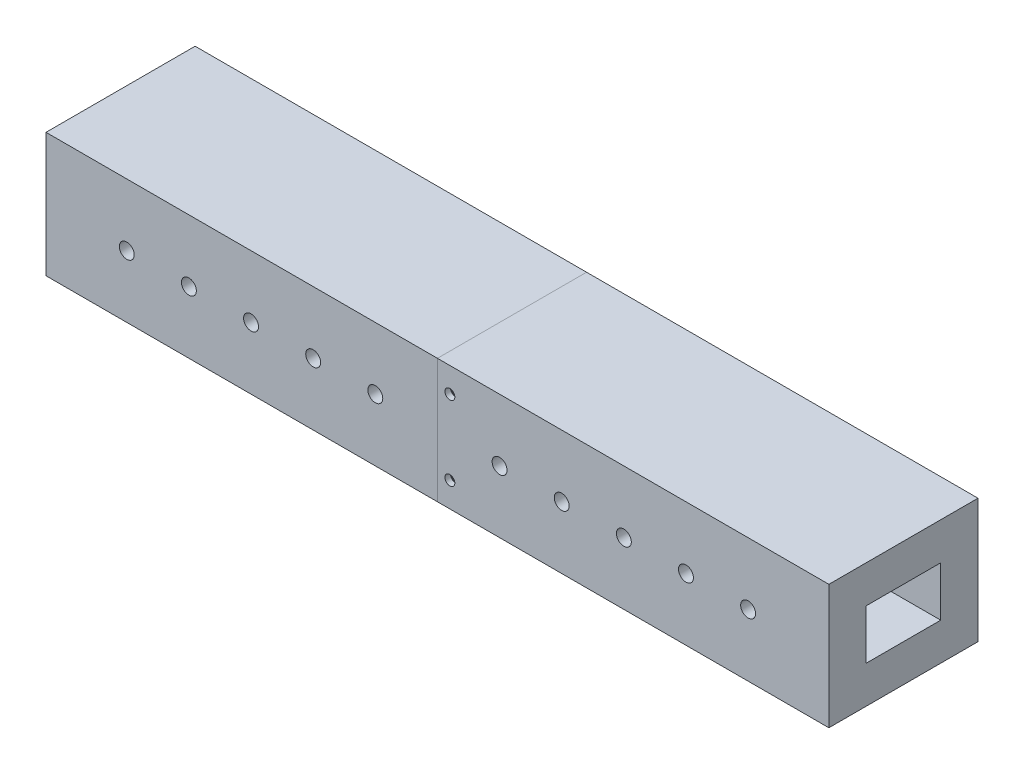
from build123d import *

# Parameters (mm, degrees)
SKETCH1_W           = 315
SKETCH1_H           = 60
BOSS_EXTRUDE1_DEPTH = 50
SKETCH2_W           = 30
SKETCH2_H           = 20
CUT_EXTRUDE1_DEPTH  = 321.351369593
SKETCH3_R           = 3
CUT_EXTRUDE2_DEPTH  = 10
SKETCH4_W           = 10.5
SKETCH4_H           = 45.5
CUT_EXTRUDE3_DEPTH  = 10
SKETCH5_R           = 2
CUT_EXTRUDE4_DEPTH  = 10
SKETCH6_W           = 10
SKETCH6_H           = 45
BOSS_EXTRUDE2_DEPTH = 10
SKETCH8_R           = 2
CUT_EXTRUDE6_DEPTH  = 175.964282069
SKETCH9_R           = 2
CUT_EXTRUDE7_DEPTH  = 10
SKETCH10_R          = 2
CUT_EXTRUDE8_DEPTH  = 10


with BuildPart() as part:
    # Sketch1 → Boss-Extrude1 (new body)
    with BuildSketch(Plane(origin=(0, 0, 0), x_dir=(1, 0, 0), z_dir=(0, 1, 0))):
        Rectangle(SKETCH1_W, SKETCH1_H)
    extrude(amount=BOSS_EXTRUDE1_DEPTH)

    # Sketch2 → Cut-Extrude1 (cut, through all)
    with BuildSketch(Plane.ZY.offset(157.5)):
        with Locations((0, 25)):
            Rectangle(SKETCH2_W, SKETCH2_H)
    extrude(amount=-CUT_EXTRUDE1_DEPTH, mode=Mode.SUBTRACT)

    # Sketch3 → Cut-Extrude2 (cut)
    with BuildSketch(Plane.XY.offset(30)):
        with Locations((-25, 25)):
            Circle(SKETCH3_R)
        with Locations((-50, 25)):
            Circle(SKETCH3_R)
        with Locations((-75, 25)):
            Circle(SKETCH3_R)
        with Locations((-100, 25)):
            Circle(SKETCH3_R)
        with Locations((-125, 25)):
            Circle(SKETCH3_R)
        with Locations(Location((125, 25, 0), (0, 0, 180))):
            Circle(SKETCH3_R)
        with Locations(Location((100, 25, 0), (0, 0, 180))):
            Circle(SKETCH3_R)
        with Locations(Location((75, 25, 0), (0, 0, 180))):
            Circle(SKETCH3_R)
        with Locations(Location((50, 25, 0), (0, 0, 180))):
            Circle(SKETCH3_R)
        with Locations(Location((25, 25, 0), (0, 0, 180))):
            Circle(SKETCH3_R)
    extrude(amount=-CUT_EXTRUDE2_DEPTH, mode=Mode.SUBTRACT)


with BuildPart() as body_2:
    # Split1: the piece on the far side of the plane
    add(part.part)
    split(bisect_by=Plane(origin=(0, 0, 0), x_dir=(0, 0, 1), z_dir=(1, 0, 0)), keep=Keep.BOTTOM)

    # Sketch6 → Boss-Extrude2 (add)
    with BuildSketch(Plane(origin=(0, 0, 0), x_dir=(0, 0, -1), z_dir=(1, 0, 0))):
        with Locations((-22.5, 25)):
            Rectangle(SKETCH6_W, SKETCH6_H)
        with Locations((22.5, 25)):
            Rectangle(SKETCH6_W, SKETCH6_H)
    extrude(amount=BOSS_EXTRUDE2_DEPTH)

    # Sketch8 → Cut-Extrude6 (cut, through all)
    with BuildSketch(Plane.XY.offset(27.5)):
        with Locations((5, 40)):
            Circle(SKETCH8_R)
        with Locations(Location((5, 10, 0), (0, 0, 270))):
            Circle(SKETCH8_R)
    extrude(amount=-CUT_EXTRUDE6_DEPTH, mode=Mode.SUBTRACT)


with BuildPart() as part_1:
    add(part.part)

    # Split1
    split(bisect_by=Plane(origin=(0, 0, 0), x_dir=(0, 0, 1), z_dir=(1, 0, 0)), keep=Keep.TOP)

    # Sketch4 → Cut-Extrude3 (cut)
    with BuildSketch(Plane.ZY):
        with Locations((22.5, 25)):
            Rectangle(SKETCH4_W, SKETCH4_H)
        with Locations((-22.5, 25)):
            Rectangle(SKETCH4_W, SKETCH4_H)
    extrude(amount=-CUT_EXTRUDE3_DEPTH, mode=Mode.SUBTRACT)

    # Sketch5 → Cut-Extrude4 (cut)
    with BuildSketch(Plane.XY.offset(30)):
        with Locations((5, 40)):
            Circle(SKETCH5_R)
        with Locations(Location((5, 10, 0), (0, 0, 270))):
            Circle(SKETCH5_R)
    cut_extrude4 = extrude(amount=-CUT_EXTRUDE4_DEPTH, mode=Mode.SUBTRACT)

    # Mirror1: Cut-Extrude4 across plane
    add(cut_extrude4.mirror(Plane.XY), mode=Mode.SUBTRACT)


with BuildPart() as cut_extrude7_tool:
    # Sketch9 → Cut-Extrude7 (new body)
    with BuildSketch(Plane.XZ):
        with Locations(Location((137.5, 15, 0), (0, 0, 270))):
            Circle(SKETCH9_R)
        with Locations(Location((137.5, -15, 0), (0, 0, 90))):
            Circle(SKETCH9_R)
        with Locations(Location((-137.5, -15, 0), (0, 0, 270))):
            Circle(SKETCH9_R)
        with Locations(Location((-137.5, 15, 0), (0, 0, 90))):
            Circle(SKETCH9_R)
    extrude(amount=-CUT_EXTRUDE7_DEPTH)


with BuildPart() as part_2:
    add(part_1.part)

    # Cut-Extrude7: cut by cut_extrude7_tool
    add(cut_extrude7_tool.part, mode=Mode.SUBTRACT)


with BuildPart() as body_2_1:
    add(body_2.part)

    # Cut-Extrude7: cut by cut_extrude7_tool
    add(cut_extrude7_tool.part, mode=Mode.SUBTRACT)


with BuildPart() as cut_extrude8_tool:
    # Sketch10 → Cut-Extrude8 (new body)
    with BuildSketch(Plane(origin=(0, 0, -30), x_dir=(-1, 0, 0), z_dir=(0, 0, -1))):
        with Locations((30, 40)):
            Circle(SKETCH10_R)
        with Locations(Location((30, 10, 0), (0, 0, 180))):
            Circle(SKETCH10_R)
        with Locations((-30, 10)):
            Circle(SKETCH10_R)
        with Locations(Location((-30, 40, 0), (0, 0, 180))):
            Circle(SKETCH10_R)
    extrude(amount=-CUT_EXTRUDE8_DEPTH)


with BuildPart() as part_3:
    add(part_2.part)

    # Cut-Extrude8: cut by cut_extrude8_tool
    add(cut_extrude8_tool.part, mode=Mode.SUBTRACT)


with BuildPart() as body_2_2:
    add(body_2_1.part)

    # Cut-Extrude8: cut by cut_extrude8_tool
    add(cut_extrude8_tool.part, mode=Mode.SUBTRACT)


solid = Compound([part_3.part, body_2_2.part])
